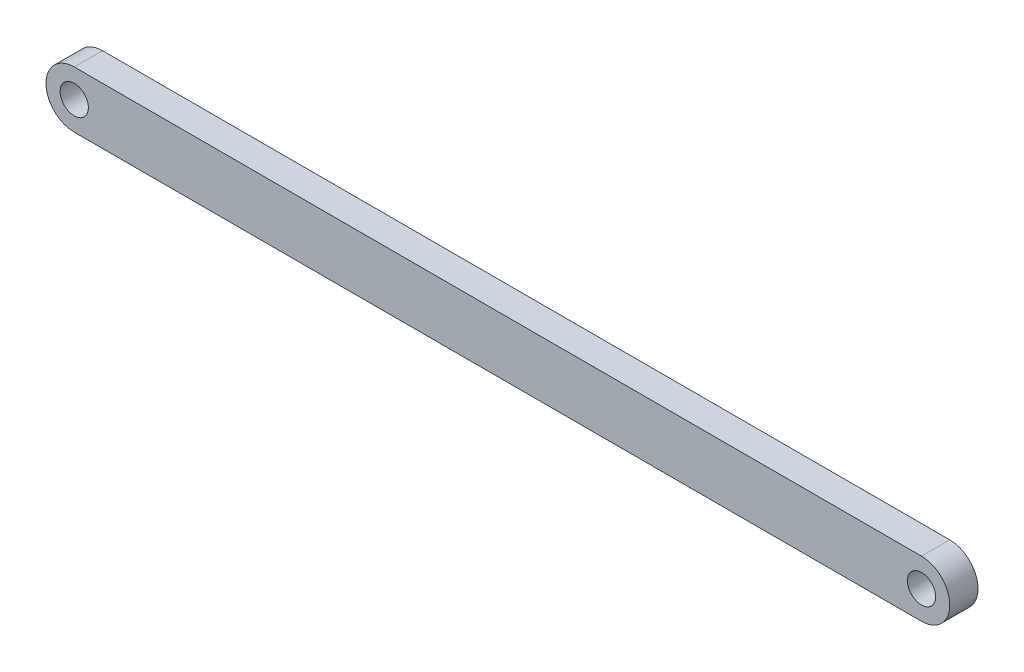
from build123d import *

# Parameters (mm, degrees)
ESBO_O1_R                = 5
RESSALTO_EXTRUS_O1_DEPTH = 10


with BuildPart() as part:
    # Esboço1 → Ressalto-extrusão1 (new body)
    with BuildSketch(Plane.XY):
        with BuildLine():
            Line((-150, 10), (150, 10))
            ThreePointArc((150, 10), (160, 0), (150, -10))
            Line((150, -10), (-150, -10))
            ThreePointArc((-150, -10), (-160, 0), (-150, 10))
        make_face()
        with Locations((-150, 0)):
            Circle(ESBO_O1_R, mode=Mode.SUBTRACT)
        with Locations((150, 0)):
            Circle(ESBO_O1_R, mode=Mode.SUBTRACT)
    extrude(amount=RESSALTO_EXTRUS_O1_DEPTH)


solid = part.part
